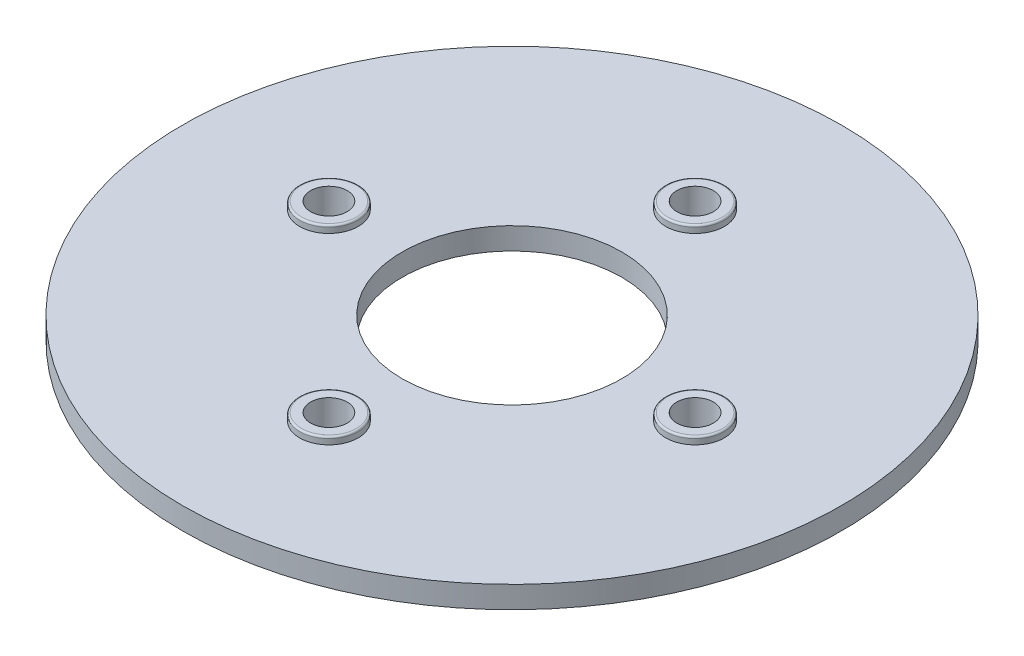
from build123d import *

# Parameters (mm, degrees)
SKETCH1_R           = 45
SKETCH1_R_2         = 15
SKETCH1_R_3         = 2.5
BOSS_EXTRUDE1_DEPTH = 3
SKETCH2_R           = 4
SKETCH2_R_2         = 2.5
BOSS_EXTRUDE2_DEPTH = 1
FILLET1_R           = 0.25


with BuildPart() as part:
    # Sketch1 → Boss-Extrude1 (new body)
    with BuildSketch(Plane(origin=(0, 0, 0), x_dir=(1, 0, 0), z_dir=(0, 1, 0))):
        with Locations(Location((0, 0, 0), (0, 0, 270))):
            Circle(SKETCH1_R)
        with Locations(Location((0, 0, 0), (0, 0, 270))):
            Circle(SKETCH1_R_2, mode=Mode.SUBTRACT)
        with Locations(Location((0, 25, 0), (0, 0, 270))):
            Circle(SKETCH1_R_3, mode=Mode.SUBTRACT)
        with Locations(Location((25, 0, 0), (0, 0, 270))):
            Circle(SKETCH1_R_3, mode=Mode.SUBTRACT)
        with Locations(Location((0, -25, 0), (0, 0, 270))):
            Circle(SKETCH1_R_3, mode=Mode.SUBTRACT)
        with Locations(Location((-25, 0, 0), (0, 0, 270))):
            Circle(SKETCH1_R_3, mode=Mode.SUBTRACT)
    extrude(amount=BOSS_EXTRUDE1_DEPTH)

    # Sketch2 → Boss-Extrude2 (add)
    # profile 1 of 4: a face of its own
    with BuildSketch(Plane(origin=(0, 3, 0), x_dir=(1, 0, 0), z_dir=(0, 1, 0))):
        with Locations(Location((25, 0, 0), (0, 0, 270))):
            Circle(SKETCH2_R)
        with Locations(Location((25, 0, 0), (0, 0, 270))):
            Circle(SKETCH2_R_2, mode=Mode.SUBTRACT)
    # profile 2 of 4: a face of its own
    with BuildSketch(Plane(origin=(0, 3, 0), x_dir=(1, 0, 0), z_dir=(0, 1, 0))):
        with Locations(Location((0, 25, 0), (0, 0, 270))):
            Circle(SKETCH2_R)
        with Locations(Location((0, 25, 0), (0, 0, 270))):
            Circle(SKETCH2_R_2, mode=Mode.SUBTRACT)
    # profile 3 of 4: a face of its own
    with BuildSketch(Plane(origin=(0, 3, 0), x_dir=(1, 0, 0), z_dir=(0, 1, 0))):
        with Locations(Location((0, -25, 0), (0, 0, 270))):
            Circle(SKETCH2_R)
        with Locations(Location((0, -25, 0), (0, 0, 270))):
            Circle(SKETCH2_R_2, mode=Mode.SUBTRACT)
    # profile 4 of 4: a face of its own
    with BuildSketch(Plane(origin=(0, 3, 0), x_dir=(1, 0, 0), z_dir=(0, 1, 0))):
        with Locations(Location((-25, 0, 0), (0, 0, 270))):
            Circle(SKETCH2_R)
        with Locations(Location((-25, 0, 0), (0, 0, 270))):
            Circle(SKETCH2_R_2, mode=Mode.SUBTRACT)
    extrude(amount=BOSS_EXTRUDE2_DEPTH)

    # Fillet1
    fillet1_edges = [part.edges().sort_by_distance(p)[0] for p in [
        (-25, 4, -4),
        (0, 4, 21),
        (25, 4, -4),
        (0, 4, -29),
    ]]
    fillet(fillet1_edges, radius=FILLET1_R)


solid = part.part
